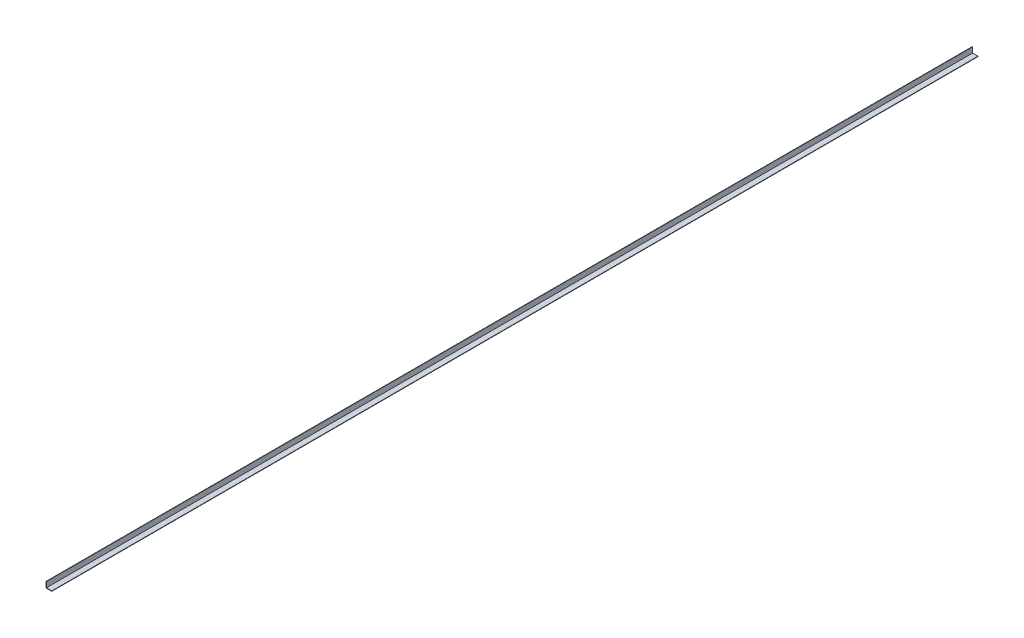
from build123d import *

# Parameters (mm, degrees)
SALIENTE_EXTRUIR1_DEPTH = 6100


with BuildPart() as part:
    # Croquis1 → Saliente-Extruir1 (new body)
    with BuildSketch(Plane.XY):
        Polygon((0, 38.1), (0, 0), (38.1, 0), (38.1, 2.7), (2.7, 2.7), (2.7, 38.1), align=None)
    extrude(amount=-SALIENTE_EXTRUIR1_DEPTH)


solid = part.part
